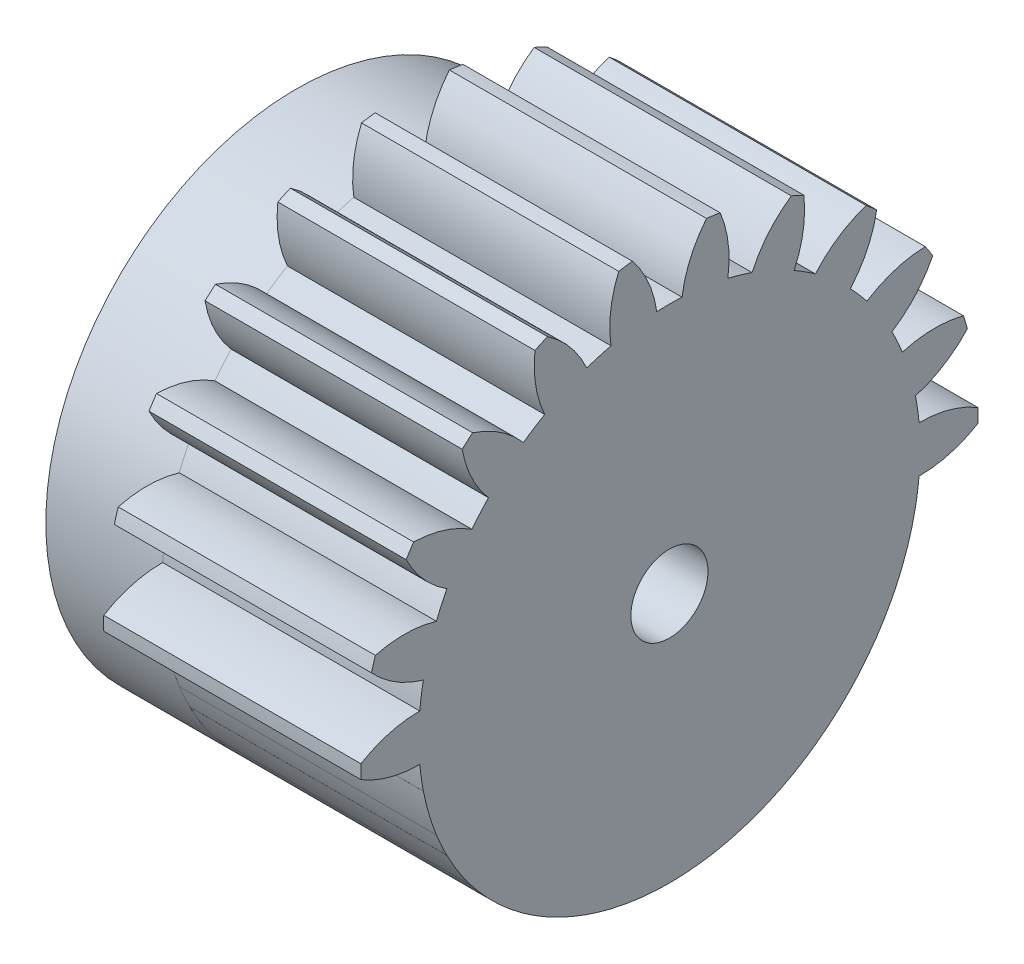
from build123d import *

# Parameters (mm, degrees)
SKETCH5_R           = 1.5
BOSS_EXTRUDE1_DEPTH = 10
SKETCH10_W          = 4.5
SKETCH10_H          = 6.3
CUT_EXTRUDE1_DEPTH  = 10
SKETCH13_R          = 4.1
CUT_EXTRUDE2_DEPTH  = 4.5
SKETCH14_R          = 3.25
CUT_EXTRUDE3_DEPTH  = 3


with BuildPart() as part:
    # Sketch5 → Boss-Extrude1 (new body)
    with BuildSketch(Plane(origin=(4.038890567, 0, 0), x_dir=(0, 0, -1), z_dir=(1, 0, 0))):
        with BuildLine():
            ThreePointArc((-8.767047038, 4.183890551), (-7.665653193, 3.710793481), (-6.477446097, 3.552511658))
            ThreePointArc((-6.477446097, 3.552511658), (-6.419815651, 3.06474668), (-6.337692385, 2.580503238))
            ThreePointArc((-6.337692385, 2.580503238), (-7.433175602, 2.093876318), (-8.35666841, 1.329644499))
            ThreePointArc((-8.35666841, 1.329644499), (-8.283962098, 1.071383356), (-8.205500024, 0.814812257))
            ThreePointArc((-8.205500024, 0.814812257), (-7.015433522, 0.671177447), (-5.830764019, 0.854063773))
            ThreePointArc((-5.830764019, 0.854063773), (-5.638048737, 0.402293077), (-5.422824897, -0.039198306))
            ThreePointArc((-5.422824897, -0.039198306), (-6.3368347, -0.814746704), (-7.007610576, -1.808199754))
            ThreePointArc((-7.007610576, -1.808199754), (-6.865088808, -2.035515771), (-6.717520569, -2.259588617))
            ThreePointArc((-6.717520569, -2.259588617), (-5.535193519, -2.06212473), (-4.450036487, -1.552886617))
            ThreePointArc((-4.450036487, -1.552886617), (-4.137849015, -1.932063257), (-3.806960756, -2.295035573))
            ThreePointArc((-3.806960756, -2.295035573), (-4.465449507, -3.296675131), (-4.829166179, -4.438865755))
            ThreePointArc((-4.829166179, -4.438865755), (-4.628375221, -4.616820854), (-4.423655917, -4.790242398))
            ThreePointArc((-4.423655917, -4.790242398), (-3.344853426, -4.267677163), (-2.447121834, -3.473342707))
            ThreePointArc((-2.447121834, -3.473342707), (-2.040753744, -3.749206653), (-1.621007666, -4.004254045))
            ThreePointArc((-1.621007666, -4.004254045), (-1.970628521, -5.150837883), (-1.997819828, -6.349232589))
            ThreePointArc((-1.997819828, -6.349232589), (-1.75502657, -6.463409906), (-1.50974134, -6.572130566))
            ThreePointArc((-1.50974134, -6.572130566), (-0.62186157, -5.76679911), (0.015715707, -4.751720564))
            ThreePointArc((0.015715707, -4.751720564), (0.483342889, -4.901922961), (0.957941455, -5.028383006))
            ThreePointArc((0.957941455, -5.028383006), (0.945512697, -6.22702172), (1.257049634, -7.384533696))
            ThreePointArc((1.257049634, -7.384533696), (1.522175527, -7.425683264), (1.788155131, -7.460895139))
            ThreePointArc((1.788155131, -7.460895139), (2.413181441, -6.438040628), (2.738951684, -5.284453619))
            ThreePointArc((2.738951684, -5.284453619), (3.229953586, -5.296825962), (3.720955487, -5.284453619))
            ThreePointArc((3.720955487, -5.284453619), (4.04672573, -6.438040628), (4.671752041, -7.460895139))
            ThreePointArc((4.671752041, -7.460895139), (4.937731645, -7.425683264), (5.202857538, -7.384533696))
            ThreePointArc((5.202857538, -7.384533696), (5.514394474, -6.22702172), (5.501965716, -5.028383006))
            ThreePointArc((5.501965716, -5.028383006), (5.976564282, -4.901922961), (6.444191465, -4.751720564))
            ThreePointArc((6.444191465, -4.751720564), (7.081768742, -5.76679911), (7.969648512, -6.572130566))
            ThreePointArc((7.969648512, -6.572130566), (8.214933742, -6.463409906), (8.457727, -6.349232589))
            ThreePointArc((8.457727, -6.349232589), (8.430535693, -5.150837883), (8.080914837, -4.004254045))
            ThreePointArc((8.080914837, -4.004254045), (8.500660915, -3.749206653), (8.907029006, -3.473342707))
            ThreePointArc((8.907029006, -3.473342707), (9.804760597, -4.267677163), (10.883563088, -4.790242398))
            ThreePointArc((10.883563088, -4.790242398), (11.088282393, -4.616820854), (11.289073351, -4.438865755))
            ThreePointArc((11.289073351, -4.438865755), (10.925356678, -3.296675131), (10.266867928, -2.295035573))
            ThreePointArc((10.266867928, -2.295035573), (10.597756186, -1.932063257), (10.909943659, -1.552886617))
            ThreePointArc((10.909943659, -1.552886617), (11.995100691, -2.06212473), (13.17742774, -2.259588617))
            ThreePointArc((13.17742774, -2.259588617), (13.32499598, -2.035515771), (13.467517748, -1.808199754))
            ThreePointArc((13.467517748, -1.808199754), (12.796741871, -0.814746704), (11.882732068, -0.039198306))
            ThreePointArc((11.882732068, -0.039198306), (12.097955909, 0.402293077), (12.290671191, 0.854063773))
            ThreePointArc((12.290671191, 0.854063773), (13.475340694, 0.671177447), (14.665407196, 0.814812257))
            ThreePointArc((14.665407196, 0.814812257), (14.743869269, 1.071383356), (14.816575582, 1.329644499))
            ThreePointArc((14.816575582, 1.329644499), (13.893082774, 2.093876318), (12.797599556, 2.580503238))
            ThreePointArc((12.797599556, 2.580503238), (12.879722823, 3.06474668), (12.937353269, 3.552511658))
            ThreePointArc((12.937353269, 3.552511658), (14.125560365, 3.710793481), (15.22695421, 4.183890551))
            ThreePointArc((15.22695421, 4.183890551), (15.229953586, 4.452174038), (15.22695421, 4.720457526))
            ThreePointArc((15.22695421, 4.720457526), (14.125560365, 5.193554596), (12.937353269, 5.351836419))
            ThreePointArc((12.937353269, 5.351836419), (12.879722823, 5.839601397), (12.797599556, 6.323844839))
            ThreePointArc((12.797599556, 6.323844839), (13.893082774, 6.810471759), (14.816575582, 7.574703578))
            ThreePointArc((14.816575582, 7.574703578), (14.743869269, 7.832964721), (14.665407196, 8.08953582))
            ThreePointArc((14.665407196, 8.08953582), (13.475340694, 8.23317063), (12.290671191, 8.050284304))
            ThreePointArc((12.290671191, 8.050284304), (12.097955909, 8.502055), (11.882732068, 8.943546382))
            ThreePointArc((11.882732068, 8.943546382), (12.796741871, 9.719094781), (13.467517748, 10.712547831))
            ThreePointArc((13.467517748, 10.712547831), (13.32499598, 10.939863848), (13.17742774, 11.163936694))
            ThreePointArc((13.17742774, 11.163936694), (11.995100691, 10.966472807), (10.909943659, 10.457234694))
            ThreePointArc((10.909943659, 10.457234694), (10.597756186, 10.836411334), (10.266867928, 11.19938365))
            ThreePointArc((10.266867928, 11.19938365), (10.925356678, 12.201023208), (11.289073351, 13.343213832))
            ThreePointArc((11.289073351, 13.343213832), (11.088282393, 13.521168931), (10.883563088, 13.694590475))
            ThreePointArc((10.883563088, 13.694590475), (9.804760597, 13.17202524), (8.907029006, 12.377690783))
            ThreePointArc((8.907029006, 12.377690783), (8.500660915, 12.65355473), (8.080914837, 12.908602122))
            ThreePointArc((8.080914837, 12.908602122), (8.430535693, 14.05518596), (8.457727, 15.253580666))
            ThreePointArc((8.457727, 15.253580666), (8.214933742, 15.367757983), (7.969648512, 15.476478643))
            ThreePointArc((7.969648512, 15.476478643), (7.081768742, 14.671147187), (6.444191465, 13.656068641))
            ThreePointArc((6.444191465, 13.656068641), (5.976564282, 13.806271038), (5.501965716, 13.932731083))
            ThreePointArc((5.501965716, 13.932731083), (5.514394474, 15.131369796), (5.202857538, 16.288881773))
            ThreePointArc((5.202857538, 16.288881773), (4.937731645, 16.330031341), (4.671752041, 16.365243215))
            ThreePointArc((4.671752041, 16.365243215), (4.04672573, 15.342388705), (3.720955487, 14.188801696))
            ThreePointArc((3.720955487, 14.188801696), (3.229953586, 14.201174038), (2.738951684, 14.188801696))
            ThreePointArc((2.738951684, 14.188801696), (2.413181441, 15.342388705), (1.788155131, 16.365243215))
            ThreePointArc((1.788155131, 16.365243215), (1.522175527, 16.330031341), (1.257049634, 16.288881773))
            ThreePointArc((1.257049634, 16.288881773), (0.945512697, 15.131369796), (0.957941455, 13.932731083))
            ThreePointArc((0.957941455, 13.932731083), (0.483342889, 13.806271038), (0.015715707, 13.656068641))
            ThreePointArc((0.015715707, 13.656068641), (-0.62186157, 14.671147187), (-1.50974134, 15.476478643))
            ThreePointArc((-1.50974134, 15.476478643), (-1.75502657, 15.367757983), (-1.997819828, 15.253580666))
            ThreePointArc((-1.997819828, 15.253580666), (-1.970628521, 14.05518596), (-1.621007666, 12.908602122))
            ThreePointArc((-1.621007666, 12.908602122), (-2.040753744, 12.65355473), (-2.447121834, 12.377690783))
            ThreePointArc((-2.447121834, 12.377690783), (-3.344853426, 13.17202524), (-4.423655917, 13.694590475))
            ThreePointArc((-4.423655917, 13.694590475), (-4.628375221, 13.521168931), (-4.829166179, 13.343213832))
            ThreePointArc((-4.829166179, 13.343213832), (-4.465449507, 12.201023208), (-3.806960756, 11.19938365))
            ThreePointArc((-3.806960756, 11.19938365), (-4.137849015, 10.836411334), (-4.450036487, 10.457234694))
            ThreePointArc((-4.450036487, 10.457234694), (-5.535193519, 10.966472807), (-6.717520569, 11.163936694))
            ThreePointArc((-6.717520569, 11.163936694), (-6.865088808, 10.939863848), (-7.007610576, 10.712547831))
            ThreePointArc((-7.007610576, 10.712547831), (-6.3368347, 9.719094781), (-5.422824897, 8.943546382))
            ThreePointArc((-5.422824897, 8.943546382), (-5.638048737, 8.502055), (-5.830764019, 8.050284304))
            ThreePointArc((-5.830764019, 8.050284304), (-7.015433522, 8.23317063), (-8.205500024, 8.08953582))
            ThreePointArc((-8.205500024, 8.08953582), (-8.283962098, 7.832964721), (-8.35666841, 7.574703578))
            ThreePointArc((-8.35666841, 7.574703578), (-7.433175602, 6.810471759), (-6.337692385, 6.323844839))
            ThreePointArc((-6.337692385, 6.323844839), (-6.419815651, 5.839601397), (-6.477446097, 5.351836419))
            ThreePointArc((-6.477446097, 5.351836419), (-7.665653193, 5.193554596), (-8.767047038, 4.720457526))
            ThreePointArc((-8.767047038, 4.720457526), (-8.770046414, 4.452174038), (-8.767047038, 4.183890551))
        make_face()
        with Locations((3.229953586, 4.452174038)):
            Circle(SKETCH5_R, mode=Mode.SUBTRACT)
    extrude(amount=-BOSS_EXTRUDE1_DEPTH)

    # Sketch11 → Cut-Extrude1 (cut)
    with BuildSketch(Plane(origin=(4.038890567, 0, 0), x_dir=(0, 0, -1), z_dir=(1, 0, 0))):
        with BuildLine():
            Line((-9.20266534, 3.156031046), (-6.433509217, 3.156031046))
            ThreePointArc((-6.433509217, 3.156031046), (3.229953586, -5.297825962), (12.893416389, 3.156031046))
            Line((12.893416389, 3.156031046), (15.662572511, 3.156031046))
            ThreePointArc((15.662572511, 3.156031046), (3.229953586, -8.047825962), (-9.20266534, 3.156031046))
        make_face()
    extrude(amount=-CUT_EXTRUDE1_DEPTH, mode=Mode.SUBTRACT)

    # Sketch14 → Cut-Extrude3 (cut)
    with BuildSketch(Plane.ZY.offset(5.961109433)):
        with Locations((-3.229953586, 4.452174038)):
            Circle(SKETCH14_R)
    extrude(amount=-CUT_EXTRUDE3_DEPTH, mode=Mode.SUBTRACT)


with BuildPart() as body_2:
    # Sketch10 → Revolve2 (revolve)
    with BuildSketch(Plane.XY.offset(-3.229953586), mode=Mode.PRIVATE) as revolve2_sk:
        with Locations((-8.211109433, 11.052174038)):
            Rectangle(SKETCH10_W, SKETCH10_H)
    revolve(revolve2_sk.sketch.rotate(Axis((-10.461109433, 4.452174038, -3.229953586), (1, 0, 0)), 270), axis=Axis((-10.461109433, 4.452174038, -3.229953586), (1, 0, 0)))

    # Sketch13 → Cut-Extrude2 (cut)
    with BuildSketch(Plane.ZY.offset(10.461109433)):
        with Locations((-3.229953586, 4.452174038)):
            Circle(SKETCH13_R)
    extrude(amount=-CUT_EXTRUDE2_DEPTH, mode=Mode.SUBTRACT)


solid = Compound([part.part, body_2.part])
